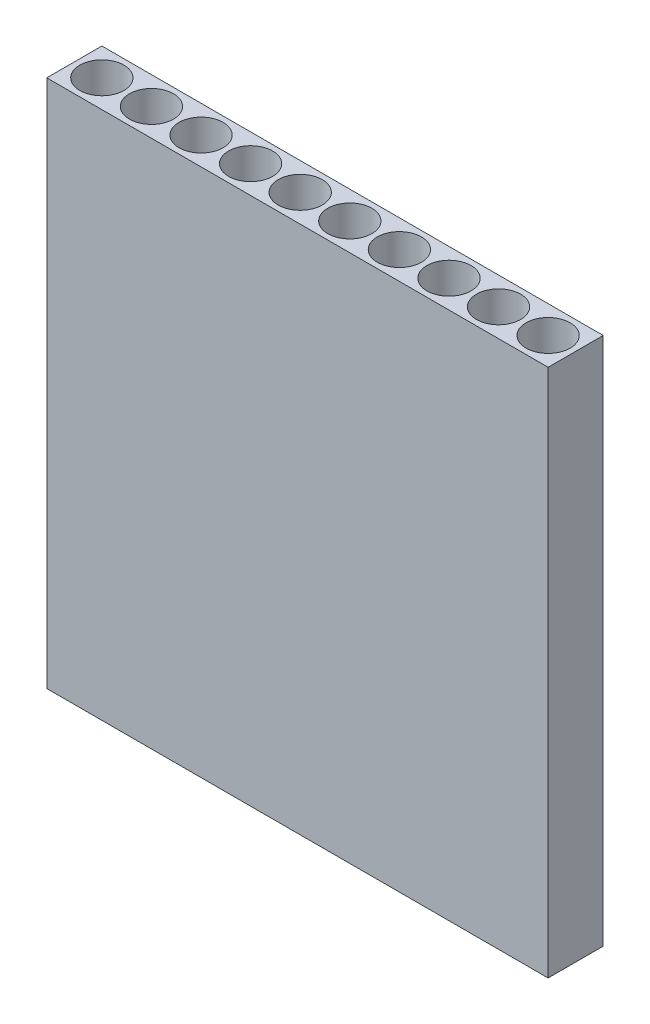
from build123d import *

# Parameters (mm, degrees)
SKETCH1_W           = 72.23125
SKETCH1_H           = 7.9375
SKETCH1_R           = 3.175
BOSS_EXTRUDE1_DEPTH = 76.2


with BuildPart() as part:
    # Sketch1 → Boss-Extrude1 (new body)
    with BuildSketch(Plane(origin=(0, 0, 0), x_dir=(1, 0, 0), z_dir=(0, 1, 0))):
        with Locations((32.146875, 0)):
            Rectangle(SKETCH1_W, SKETCH1_H)
        with Locations(Location((0, 0, 0), (0, 0, 90))):
            Circle(SKETCH1_R, mode=Mode.SUBTRACT)
        with Locations(Location((7.14375, 0, 0), (0, 0, 90))):
            Circle(SKETCH1_R, mode=Mode.SUBTRACT)
        with Locations(Location((14.2875, 0, 0), (0, 0, 90))):
            Circle(SKETCH1_R, mode=Mode.SUBTRACT)
        with Locations(Location((21.43125, 0, 0), (0, 0, 90))):
            Circle(SKETCH1_R, mode=Mode.SUBTRACT)
        with Locations(Location((28.575, 0, 0), (0, 0, 90))):
            Circle(SKETCH1_R, mode=Mode.SUBTRACT)
        with Locations(Location((35.71875, 0, 0), (0, 0, 90))):
            Circle(SKETCH1_R, mode=Mode.SUBTRACT)
        with Locations(Location((42.8625, 0, 0), (0, 0, 90))):
            Circle(SKETCH1_R, mode=Mode.SUBTRACT)
        with Locations(Location((50.00625, 0, 0), (0, 0, 90))):
            Circle(SKETCH1_R, mode=Mode.SUBTRACT)
        with Locations(Location((57.15, 0, 0), (0, 0, 90))):
            Circle(SKETCH1_R, mode=Mode.SUBTRACT)
        with Locations(Location((64.29375, 0, 0), (0, 0, 90))):
            Circle(SKETCH1_R, mode=Mode.SUBTRACT)
    extrude(amount=BOSS_EXTRUDE1_DEPTH)


solid = part.part
